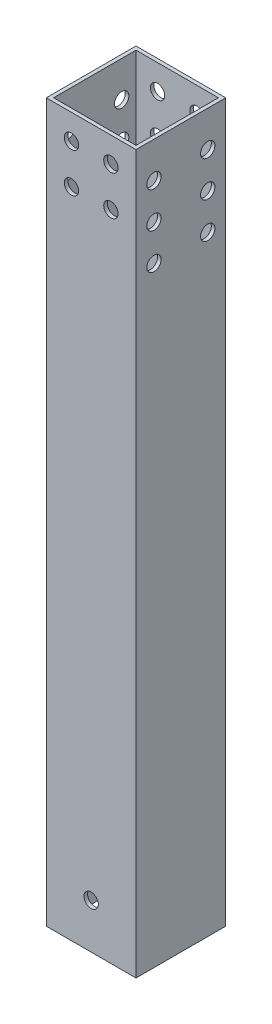
from build123d import *

# Parameters (mm, degrees)
SKETCH1_W           = 25
SKETCH1_H           = 25
SKETCH1_W_2         = 23
SKETCH1_H_2         = 23
BOSS_EXTRUDE1_DEPTH = 200
SKETCH3_R           = 2
CUT_EXTRUDE1_DEPTH  = 25
SKETCH4_R           = 2
CUT_EXTRUDE2_DEPTH  = 25
SKETCH5_R           = 2
CUT_EXTRUDE3_DEPTH  = 25


with BuildPart() as part:
    # Sketch1 → Boss-Extrude1 (new body)
    with BuildSketch(Plane(origin=(0, 0, 0), x_dir=(1, 0, 0), z_dir=(0, 1, 0))):
        Rectangle(SKETCH1_W, SKETCH1_H)
        Rectangle(SKETCH1_W_2, SKETCH1_H_2, mode=Mode.SUBTRACT)
    extrude(amount=BOSS_EXTRUDE1_DEPTH)

    # Sketch3 → Cut-Extrude1 (cut)
    with BuildSketch(Plane(origin=(12.5, 0, 0), x_dir=(0, 0, -1), z_dir=(1, 0, 0))):
        with Locations((7.5, 190)):
            Circle(SKETCH3_R)
        with Locations((7.5, 180)):
            Circle(SKETCH3_R)
        with Locations((-7.5, 190)):
            Circle(SKETCH3_R)
        with Locations((-7.5, 180)):
            Circle(SKETCH3_R)
        with Locations((7.5, 170)):
            Circle(SKETCH3_R)
        with Locations((-7.5, 170)):
            Circle(SKETCH3_R)
    extrude(amount=-CUT_EXTRUDE1_DEPTH, mode=Mode.SUBTRACT)

    # Sketch4 → Cut-Extrude2 (cut)
    with BuildSketch(Plane.XY.offset(12.5)):
        with Locations((5.5, 193)):
            Circle(SKETCH4_R)
        with Locations((5.5, 182)):
            Circle(SKETCH4_R)
    cut_extrude2 = extrude(amount=-CUT_EXTRUDE2_DEPTH, mode=Mode.SUBTRACT)

    # Sketch5 → Cut-Extrude3 (cut)
    with BuildSketch(Plane.XY.offset(12.5)):
        with Locations((0, 12.5)):
            Circle(SKETCH5_R)
    extrude(amount=-CUT_EXTRUDE3_DEPTH, mode=Mode.SUBTRACT)

    # Mirror1: Cut-Extrude2 across plane
    add(cut_extrude2.mirror(Plane(origin=(0, 0, 0), x_dir=(0, 0, 1), z_dir=(1, 0, 0))), mode=Mode.SUBTRACT)


solid = part.part
